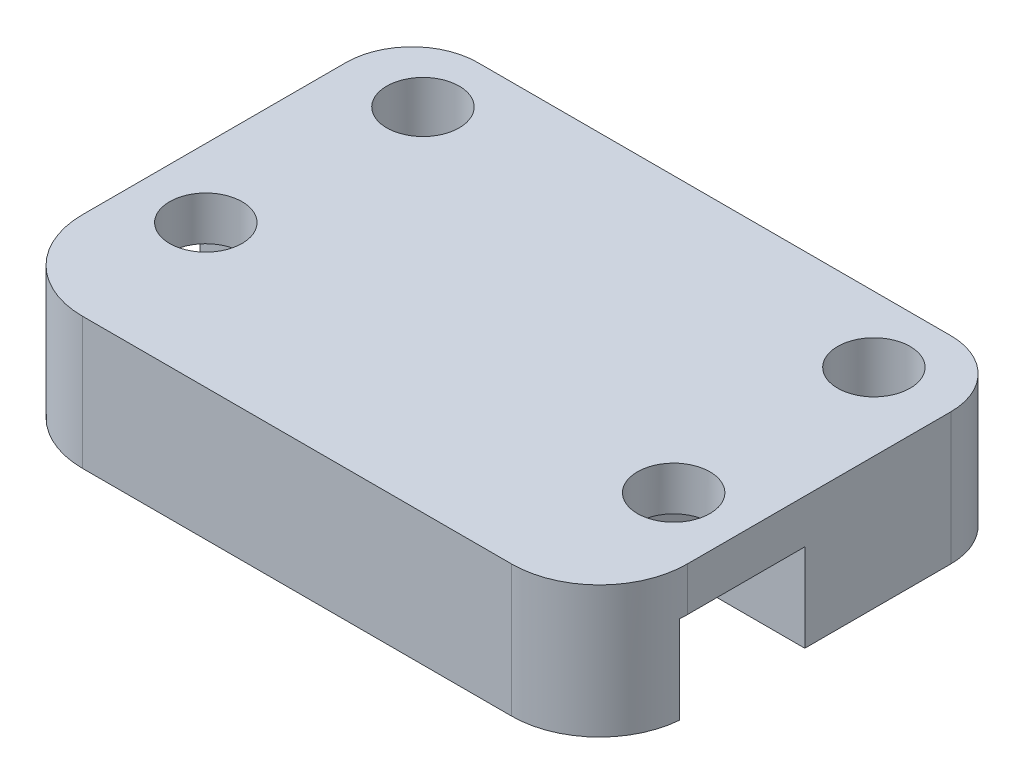
from build123d import *

# Parameters (mm, degrees)
SKETCH1_W               = 27.54
SKETCH1_H               = 6
BOSS_EXTRUDE1_DEPTH     = 13
SKETCH2_R               = 1.65
CUT_EXTRUDE1_DEPTH      = 20.86486597
SKETCH4_W               = 27.54
SKETCH4_H               = 6
BOSS_EXTRUDE2_DEPTH     = 6
FILLET1_R               = 4
FILLET2_R               = 3
CUT_EXTRUDE2_DEPTH      = 20.86486597
CUT_EXTRUDE2_DEPTH_BACK = 20.86486597
SKETCH3_R               = 1.65
CUT_EXTRUDE3_DEPTH      = 4


with BuildPart() as part:
    # Sketch1 → Boss-Extrude1 (new body)
    with BuildSketch(Plane.XY):
        Rectangle(SKETCH1_W, SKETCH1_H)
    extrude(amount=BOSS_EXTRUDE1_DEPTH)

    # Sketch2 → Cut-Extrude1 (cut, through all)
    with BuildSketch(Plane(origin=(0, 3, 0), x_dir=(1, 0, 0), z_dir=(0, 1, 0))):
        with Locations(Location((-10.65, -6.5, 0), (0, 0, 270))):
            Circle(SKETCH2_R)
        with Locations(Location((10.65, -6.5, 0), (0, 0, 270))):
            Circle(SKETCH2_R)
    extrude(amount=-CUT_EXTRUDE1_DEPTH, mode=Mode.SUBTRACT)

    # Sketch4 → Boss-Extrude2 (add)
    with BuildSketch(Plane(origin=(0, 0, 0), x_dir=(-1, 0, 0), z_dir=(0, 0, -1))):
        Rectangle(SKETCH4_W, SKETCH4_H)
    extrude(amount=BOSS_EXTRUDE2_DEPTH)

    # Fillet1
    fillet1_edges = [part.edges().sort_by_distance(p)[0] for p in [
        (-13.77, 0, 13),
        (13.77, 0, 13),
    ]]
    fillet(fillet1_edges, radius=FILLET1_R)

    # Fillet2
    fillet2_edges = [part.edges().sort_by_distance(p)[0] for p in [
        (13.77, 0, -6),
        (-13.77, 0, -6),
    ]]
    fillet(fillet2_edges, radius=FILLET2_R)

    # Sketch3 → Cut-Extrude2 (cut, two sides: drawn at the far end of the back side and taken through both)
    with BuildSketch(Plane.XZ.offset(3).offset(-CUT_EXTRUDE2_DEPTH_BACK)):
        with Locations(Location((10.265, -3, 0), (0, 0, 270))):
            Circle(SKETCH3_R)
        with Locations(Location((-10.265, -3, 0), (0, 0, 270))):
            Circle(SKETCH3_R)
    extrude(amount=CUT_EXTRUDE2_DEPTH + CUT_EXTRUDE2_DEPTH_BACK, mode=Mode.SUBTRACT)

    # Sketch6 → Cut-Extrude3 (cut)
    with BuildSketch(Plane.XZ.offset(3)):
        Polygon((12.295448267, 9.35), (15.295448267, 9.35), (15.295448267, 3.65), (12.295448267, 3.65), (9.004551733, 3.65), (7.359103466, 6.5), (9.004551733, 9.35), align=None)
        Polygon((-12.295448267, 3.65), (-9.004551733, 3.65), (-7.359103466, 6.5), (-9.004551733, 9.35), (-12.295448267, 9.35), (-15.295448267, 9.35), (-15.295448267, 3.65), align=None)
    extrude(amount=-CUT_EXTRUDE3_DEPTH, mode=Mode.SUBTRACT)


solid = part.part
